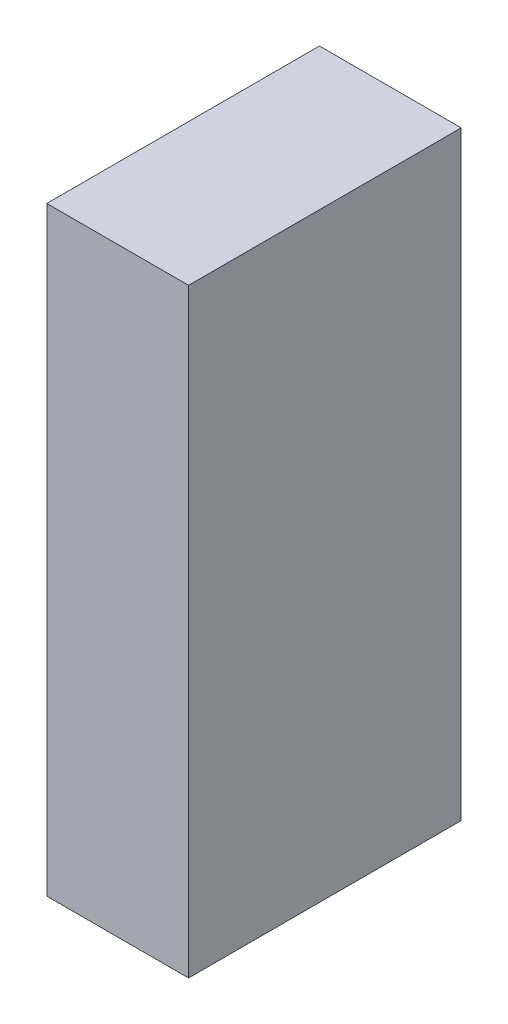
from build123d import *

# Parameters (mm, degrees)
SKETCH_1_W      = 50
SKETCH_1_H      = 110
EXTRUDE_1_DEPTH = 26


with BuildPart() as part:
    # Эскиз1 → Бобышка-Вытянуть1 (new body)
    with BuildSketch(Plane(origin=(0, 0, 0), x_dir=(0, 0, -1), z_dir=(1, 0, 0))):
        Rectangle(SKETCH_1_W, SKETCH_1_H)
    extrude(amount=EXTRUDE_1_DEPTH)


solid = part.part
